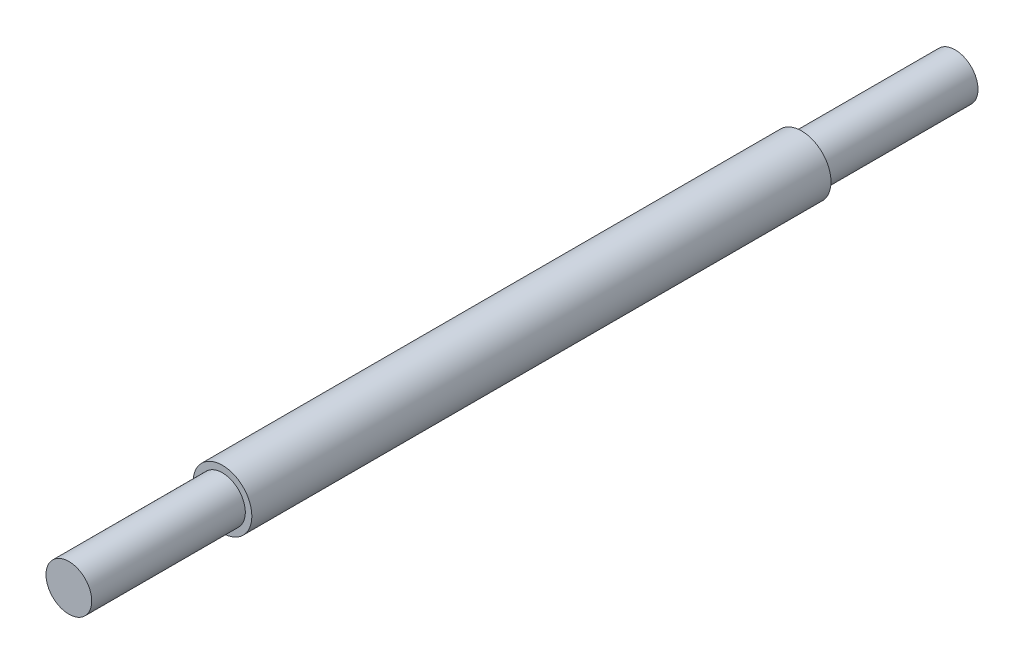
from build123d import *

# Parameters (mm, degrees)
SKETCH1_R           = 3.6
BOSS_EXTRUDE1_DEPTH = 70.9
SKETCH2_R           = 2.8
BOSS_EXTRUDE2_DEPTH = 18.8
BOSS_EXTRUDE3_START = 18.8
SKETCH3_R           = 2.8
BOSS_EXTRUDE3_DEPTH = 18.8


with BuildPart() as part:
    # Sketch1 → Boss-Extrude1 (new body)
    with BuildSketch(Plane.XY):
        Circle(SKETCH1_R)
    extrude(amount=BOSS_EXTRUDE1_DEPTH)

    # Sketch2 → Boss-Extrude2 (add)
    with BuildSketch(Plane.XY.offset(70.9)):
        with Locations(Location((0, 0, 0), (0, 0, 180))):
            Circle(SKETCH2_R)
    extrude(amount=BOSS_EXTRUDE2_DEPTH)

    # Sketch3 → Boss-Extrude3 (add)
    with BuildSketch(Plane(origin=(0, 0, 0), x_dir=(-1, 0, 0), z_dir=(0, 0, -1)).offset(BOSS_EXTRUDE3_START)):
        Circle(SKETCH3_R)
    extrude(amount=-BOSS_EXTRUDE3_DEPTH)


solid = part.part
